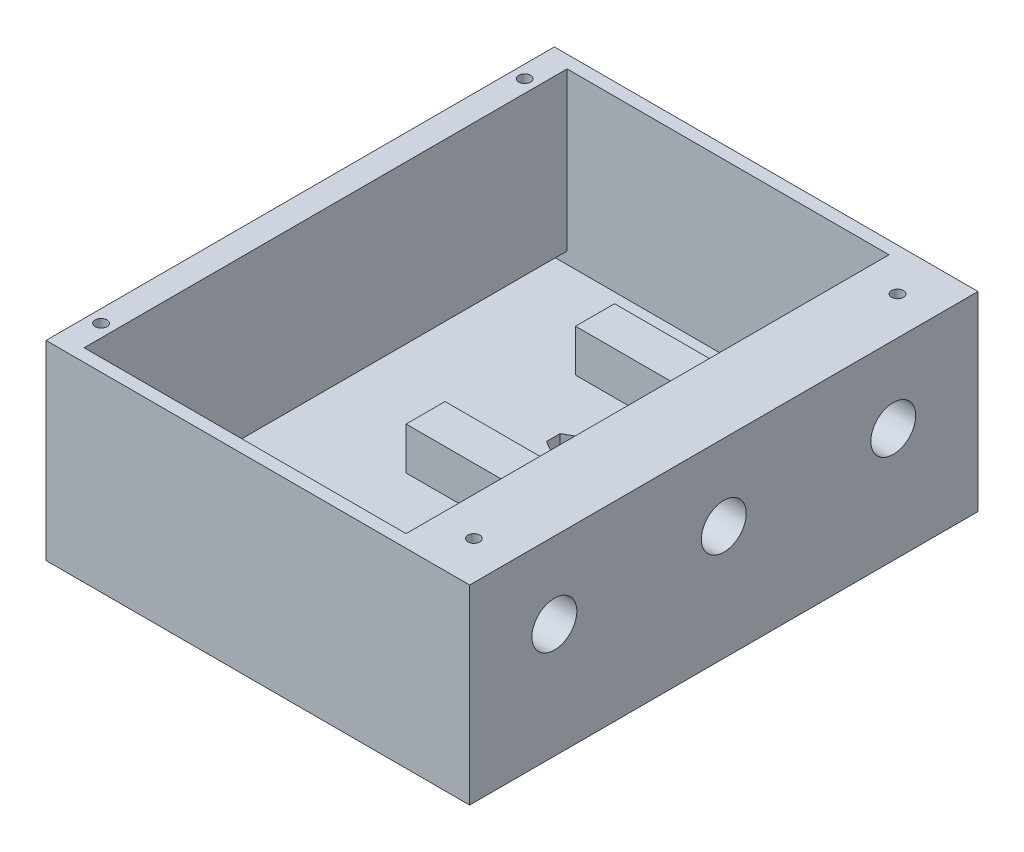
from build123d import *

# Parameters (mm, degrees)
SKETCH1_W           = 100
SKETCH1_H           = 120
BOSS_EXTRUDE1_DEPTH = 5
SKETCH2_W           = 100
SKETCH2_H           = 120
SKETCH2_W_2         = 94
SKETCH2_H_2         = 114
BOSS_EXTRUDE2_DEPTH = 40
SKETCH3_W           = 40.8
SKETCH3_H           = 9.2
BOSS_EXTRUDE3_DEPTH = 10
SKETCH4_W           = 114
SKETCH4_H           = 40
BOSS_EXTRUDE4_DEPTH = 15
SKETCH5_R           = 5.3
CUT_EXTRUDE1_DEPTH  = 18
SKETCH8_R           = 1.6
CUT_EXTRUDE2_DEPTH  = 88.749643874
CUT_EXTRUDE3_DEPTH  = 3
SKETCH10_W          = 114
SKETCH10_H          = 37.223183771
BOSS_EXTRUDE6_DEPTH = 3
SKETCH11_R          = 1.4
CUT_EXTRUDE4_DEPTH  = 40
SKETCH14_W          = 12.8
SKETCH14_H          = 15
CUT_EXTRUDE5_DEPTH  = 5
CUT_EXTRUDE6_DEPTH  = 2


with BuildPart() as part:
    # Sketch1 → Boss-Extrude1 (new body)
    with BuildSketch(Plane(origin=(0, 0, 0), x_dir=(1, 0, 0), z_dir=(0, 1, 0))):
        Rectangle(SKETCH1_W, SKETCH1_H)
    extrude(amount=BOSS_EXTRUDE1_DEPTH)

    # Sketch2 → Boss-Extrude2 (add)
    with BuildSketch(Plane(origin=(0, 5, 0), x_dir=(1, 0, 0), z_dir=(0, 1, 0))):
        Rectangle(SKETCH2_W, SKETCH2_H)
        Rectangle(SKETCH2_W_2, SKETCH2_H_2, mode=Mode.SUBTRACT)
    extrude(amount=BOSS_EXTRUDE2_DEPTH)

    # Sketch3 → Boss-Extrude3 (add)
    with BuildSketch(Plane(origin=(0, 5, 0), x_dir=(1, 0, 0), z_dir=(0, 1, 0))):
        with Locations((0, 40)):
            Rectangle(SKETCH3_W, SKETCH3_H)
        Rectangle(SKETCH3_W, SKETCH3_H)
        with Locations((0, -40)):
            Rectangle(SKETCH3_W, SKETCH3_H)
    extrude(amount=BOSS_EXTRUDE3_DEPTH)

    # Sketch4 → Boss-Extrude4 (add)
    with BuildSketch(Plane.ZY.offset(-47)):
        with Locations((0, 25)):
            Rectangle(SKETCH4_W, SKETCH4_H)
    extrude(amount=BOSS_EXTRUDE4_DEPTH)

    # Sketch5 → Cut-Extrude1 (cut)
    with BuildSketch(Plane.ZY.offset(-32)):
        with Locations((-40, 27)):
            Circle(SKETCH5_R)
        with Locations((0, 27)):
            Circle(SKETCH5_R)
        with Locations((40, 27)):
            Circle(SKETCH5_R)
    extrude(amount=-CUT_EXTRUDE1_DEPTH, mode=Mode.SUBTRACT)

    # Sketch8 → Cut-Extrude2 (cut, through all)
    with BuildSketch(Plane(origin=(0, 5, 0), x_dir=(1, 0, 0), z_dir=(0, 1, 0))):
        with Locations(Location((-7.5, -20, 0), (0, 0, 270))):
            Circle(SKETCH8_R)
        with Locations(Location((-7.5, 20, 0), (0, 0, 270))):
            Circle(SKETCH8_R)
    extrude(amount=-CUT_EXTRUDE2_DEPTH, mode=Mode.SUBTRACT)

    # Sketch9 → Cut-Extrude3 (cut)
    with BuildSketch(Plane(origin=(0, 5, 0), x_dir=(1, 0, 0), z_dir=(0, 1, 0))):
        Polygon((-10.271281292, -21.6), (-7.5, -23.2), (-4.728718708, -21.6), (-4.728718708, -18.4), (-7.5, -16.8), (-10.271281292, -18.4), align=None)
        Polygon((-10.271281292, 21.6), (-10.271281292, 18.4), (-7.5, 16.8), (-4.728718708, 18.4), (-4.728718708, 21.6), (-7.5, 23.2), align=None)
    extrude(amount=-CUT_EXTRUDE3_DEPTH, mode=Mode.SUBTRACT)

    # Sketch10 → Boss-Extrude6 (add)
    with BuildSketch(Plane(origin=(-47, 0, 0), x_dir=(0, 0, -1), z_dir=(1, 0, 0))):
        with Locations((0, 26.388408114)):
            Rectangle(SKETCH10_W, SKETCH10_H)
    extrude(amount=BOSS_EXTRUDE6_DEPTH)

    # Sketch11 → Cut-Extrude4 (cut)
    with BuildSketch(Plane(origin=(0, 45, 0), x_dir=(1, 0, 0), z_dir=(0, 1, 0))):
        with Locations(Location((41, -50, 0), (0, 0, 270))):
            Circle(SKETCH11_R)
        with Locations(Location((41, 50, 0), (0, 0, 270))):
            Circle(SKETCH11_R)
        with Locations(Location((-47, 50, 0), (0, 0, 270))):
            Circle(SKETCH11_R)
        with Locations(Location((-47, -50, 0), (0, 0, 270))):
            Circle(SKETCH11_R)
    extrude(amount=-CUT_EXTRUDE4_DEPTH, mode=Mode.SUBTRACT)

    # Sketch14 → Cut-Extrude5 (cut)
    with BuildSketch(Plane.XZ):
        with Locations((24, 20)):
            Rectangle(SKETCH14_W, SKETCH14_H)
    extrude(amount=-CUT_EXTRUDE5_DEPTH, mode=Mode.SUBTRACT)

    # Sketch15 → Cut-Extrude6 (cut)
    with BuildSketch(Plane(origin=(0, 5, 0), x_dir=(1, 0, 0), z_dir=(0, 1, 0))):
        Polygon((30.4, -12.5), (30.4, -8.5), (8.4, -8.5), (8.4, -31.5), (30.4, -31.5), (30.4, -27.5), (17.6, -27.5), (17.6, -12.5), align=None)
    extrude(amount=-CUT_EXTRUDE6_DEPTH, mode=Mode.SUBTRACT)


solid = part.part
